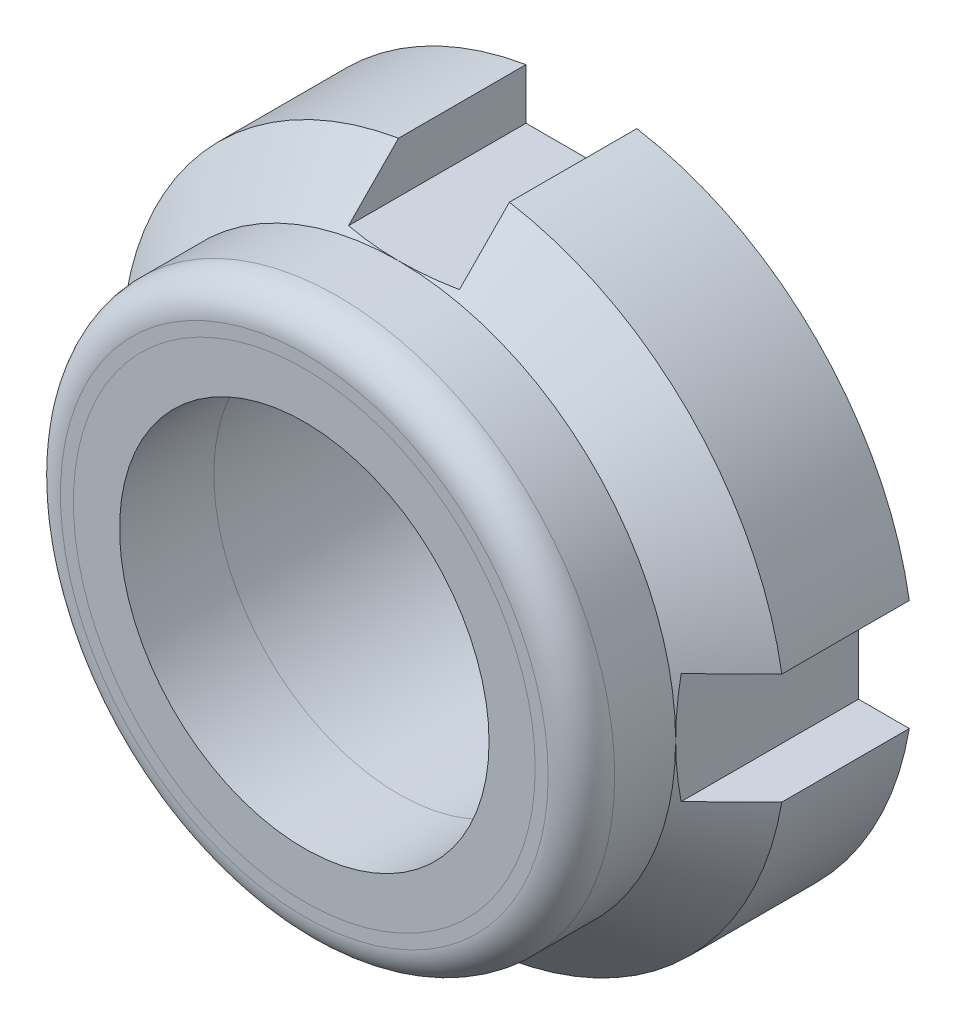
from build123d import *

# Parameters (mm, degrees)
BOSS_EXTRUDE1_DEPTH      = 3.75
BOSS_EXTRUDE1_DEPTH_BACK = 3.75
SKETCH4_R                = 9
SKETCH4_R_2              = 5
SKETCH5_R                = 9
SKETCH5_R_2              = 7.5
CUT_EXTRUDE1_DEPTH       = 0.5
SKETCH16_W               = 3
SKETCH16_H               = 1.5
CUT_EXTRUDE7_DEPTH       = 14.26885451
CIRPATTERN1_COUNT        = 4
FILLET1_R                = 0.9
SKETCH19_R               = 6.25
CUT_EXTRUDE8_DEPTH       = 2.55
SKETCH20_R               = 6.25
SKETCH20_R_2             = 5
BOSS_EXTRUDE2_DEPTH      = 2.55


with BuildPart() as part:
    # Sketch4 → Boss-Extrude1 (new, two sides: drawn at the far end of the back side and taken through both)
    with BuildSketch(Plane.XY.offset(-BOSS_EXTRUDE1_DEPTH_BACK)):
        Circle(SKETCH4_R)
        Circle(SKETCH4_R_2, mode=Mode.SUBTRACT)
    extrude(amount=BOSS_EXTRUDE1_DEPTH + BOSS_EXTRUDE1_DEPTH_BACK)

    # Sketch5 → Cut-Extrude1 (cut)
    with BuildSketch(Plane.XY.offset(3.75)):
        Circle(SKETCH5_R)
        Circle(SKETCH5_R_2, mode=Mode.SUBTRACT)
    extrude(amount=-CUT_EXTRUDE1_DEPTH, mode=Mode.SUBTRACT)

    # Sketch16 → Cut-Extrude7 (cut, symmetric)
    with BuildSketch(Plane.XY):
        with Locations((0, -8.25)):
            Rectangle(SKETCH16_W, SKETCH16_H)
    cut_extrude7 = extrude(amount=CUT_EXTRUDE7_DEPTH, both=True, mode=Mode.SUBTRACT)

    # CirPattern1: Cut-Extrude7 ×4 about axis
    cirpattern1_axis = Axis((0, 0, 0), (0, 0, 1))
    for i in range(1, CIRPATTERN1_COUNT):
        add(cut_extrude7.rotate(cirpattern1_axis, i * 360 / CIRPATTERN1_COUNT), mode=Mode.SUBTRACT)

    # Sketch18 → Cut-Revolve1 (revolve, cut)
    with BuildSketch(Plane(origin=(0, 0, 0), x_dir=(0, 0, -1), z_dir=(1, 0, 0)), mode=Mode.PRIVATE) as cut_revolve1_sk:
        Polygon((-1.2, 7.5), (0.3, 9), (-3.75, 9), (-3.75, 7.5), align=None)
    revolve(cut_revolve1_sk.sketch.rotate(Axis((0, 0, 3.75), (0, 0, -1)), 90), axis=Axis((0, 0, 3.75), (0, 0, -1)), mode=Mode.SUBTRACT)

    # Fillet1
    fillet1_edges = [part.edges().sort_by_distance(p)[0] for p in [
        (-7.5, 0, 3.75),
    ]]
    fillet(fillet1_edges, radius=FILLET1_R)

    # Sketch19 → Cut-Extrude8 (cut)
    with BuildSketch(Plane.XY.offset(3.75)):
        Circle(SKETCH19_R)
    extrude(amount=-CUT_EXTRUDE8_DEPTH, mode=Mode.SUBTRACT)


with BuildPart() as body_2:
    # Sketch20 → Boss-Extrude2 (new body)
    with BuildSketch(Plane.XY.offset(1.2)):
        Circle(SKETCH20_R)
        Circle(SKETCH20_R_2, mode=Mode.SUBTRACT)
    extrude(amount=BOSS_EXTRUDE2_DEPTH)


solid = Compound([part.part, body_2.part])
